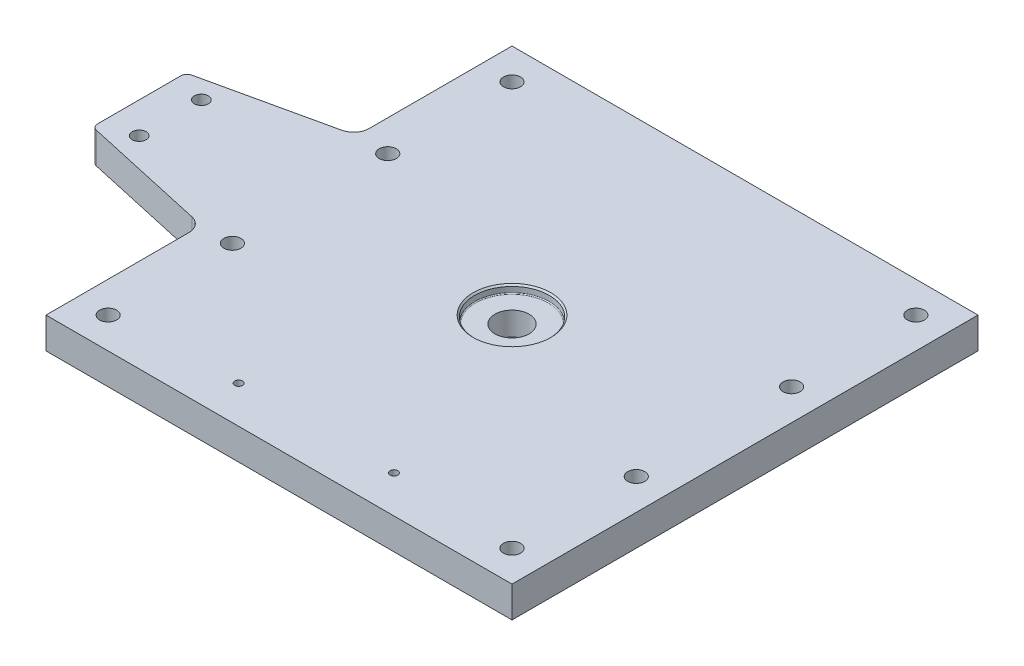
from build123d import *

# Parameters (mm, degrees)
SKETCH1_W                                           = 150
SKETCH1_H                                           = 150
BOSS_EXTRUDE1_DEPTH                                 = 5
CBORE_FOR_M5_HEX_SOCKET_HEAD_CAP_SCREW1_D           = 5.5
CBORE_FOR_M5_HEX_SOCKET_HEAD_CAP_SCREW1_CBORE_D     = 10
CBORE_FOR_M5_HEX_SOCKET_HEAD_CAP_SCREW1_CBORE_DEPTH = 5.5
F_11_0_11_DIAMETER_HOLE1_D                          = 11
SKETCH6_R                                           = 12
CUT_EXTRUDE1_DEPTH                                  = 2.5
FILLET2_R                                           = 0.3
BOSS_EXTRUDE2_DEPTH                                 = 10
FILLET3_R                                           = 5
F_4_5_4_5_DIAMETER_HOLE1_D                          = 4.5
FILLET4_R                                           = 2
M3_TAPPED_HOLE1_D                                   = 2.5
CHAMFER1_SIZE                                       = 0.5


with BuildPart() as part:
    # Sketch1 → Boss-Extrude1 (new, symmetric)
    with BuildSketch(Plane(origin=(0, 0, 0), x_dir=(1, 0, 0), z_dir=(0, 1, 0))):
        Rectangle(SKETCH1_W, SKETCH1_H)
    extrude(amount=BOSS_EXTRUDE1_DEPTH, both=True)

    # CBORE for M5 Hex Socket Head Cap Screw1 (through all)
    with Locations(Plane(origin=(0, -5, 0), x_dir=(-1, 0, 0), z_dir=(0, -1, 0))):
        with Locations((-65, -65), (-65, -25), (-65, 25), (-65, 65), (65, -65), (65, -25), (65, 25), (65, 65)):
            CounterBoreHole(CBORE_FOR_M5_HEX_SOCKET_HEAD_CAP_SCREW1_D / 2, CBORE_FOR_M5_HEX_SOCKET_HEAD_CAP_SCREW1_CBORE_D / 2, CBORE_FOR_M5_HEX_SOCKET_HEAD_CAP_SCREW1_CBORE_DEPTH)

    # Ø11.0 (11) Diameter Hole1 (through all)
    with Locations(Plane(origin=(0, -5, 0), x_dir=(-1, 0, 0), z_dir=(0, -1, 0))):
        with Locations((0, 0)):
            Hole(F_11_0_11_DIAMETER_HOLE1_D / 2)

    # Sketch6 → Cut-Extrude1 (cut)
    with BuildSketch(Plane.XZ.offset(-5)):
        with Locations(Location((0, 0, 0), (0, 0, 270))):
            Circle(SKETCH6_R)
    extrude(amount=CUT_EXTRUDE1_DEPTH, mode=Mode.SUBTRACT)

    # Fillet2
    fillet2_edges = [part.edges().sort_by_distance(p)[0] for p in [
        (0, 2.5, 12),
    ]]
    fillet(fillet2_edges, radius=FILLET2_R)

    # Sketch7 → Boss-Extrude2 (add)
    with BuildSketch(Plane(origin=(0, 5, 0), x_dir=(1, 0, 0), z_dir=(0, 1, 0))):
        Polygon((-75, 25), (-75, -25), (-120, -15), (-120, 15), align=None)
    extrude(amount=-BOSS_EXTRUDE2_DEPTH)

    # Fillet3
    fillet3_edges = [part.edges().sort_by_distance(p)[0] for p in [
        (-75, 0, -25),
        (-75, 0, 25),
    ]]
    fillet(fillet3_edges, radius=FILLET3_R)

    # Ø4.5 (4.5) Diameter Hole1 (through all)
    with Locations(Plane(origin=(0, 5, 0), x_dir=(1, 0, 0), z_dir=(0, 1, 0))):
        with Locations((-110, 10), (-110, -10)):
            Hole(F_4_5_4_5_DIAMETER_HOLE1_D / 2)

    # Fillet4
    fillet4_edges = [part.edges().sort_by_distance(p)[0] for p in [
        (-120, 0, -15),
        (-120, 0, 15),
    ]]
    fillet(fillet4_edges, radius=FILLET4_R)

    # M3 Tapped Hole1 (through all)
    with Locations(Plane(origin=(0, 5, 0), x_dir=(1, 0, 0), z_dir=(0, 1, 0))):
        with Locations((-25, -63), (25, -63)):
            Hole(M3_TAPPED_HOLE1_D / 2)

    # Chamfer1
    chamfer1_edges = [part.edges().sort_by_distance(p)[0] for p in [
        (0, 5, 12),
    ]]
    chamfer(chamfer1_edges, length=CHAMFER1_SIZE)


solid = part.part
